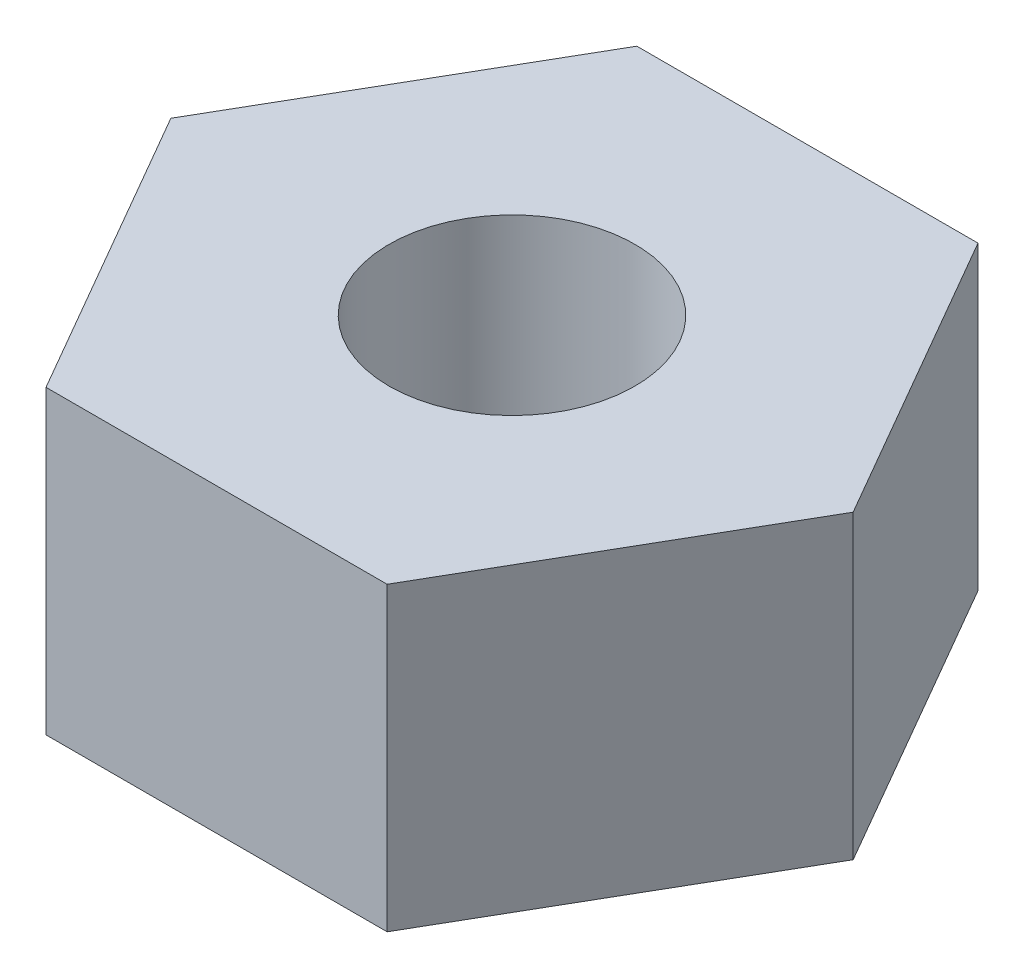
from build123d import *

# Parameters (mm, degrees)
SKETCH1_R           = 2.45
BOSS_EXTRUDE1_DEPTH = 6


with BuildPart() as part:
    # Sketch1 → Boss-Extrude1 (new body)
    with BuildSketch(Plane(origin=(0, 0, 0), x_dir=(1, 0, 0), z_dir=(0, 1, 0))):
        Polygon((-3.4, -5.888972746), (3.4, -5.888972746), (6.8, 0), (3.4, 5.888972746), (-3.4, 5.888972746), (-6.8, 0), align=None)
        with Locations(Location((0, 0, 0), (0, 0, 270))):
            Circle(SKETCH1_R, mode=Mode.SUBTRACT)
    extrude(amount=BOSS_EXTRUDE1_DEPTH)


solid = part.part
